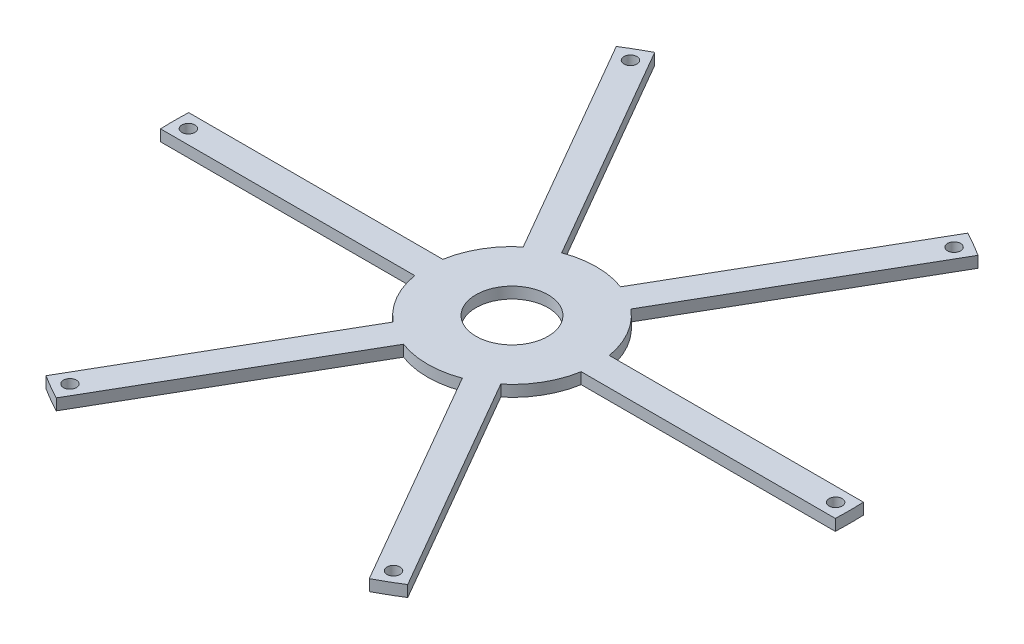
from build123d import *

# Parameters (mm, degrees)
BOSS_EXTRUDE1_DEPTH         = 2.54
F_5_8_CLEARANCE_HOLE1_D     = 16.27124
F_5_8_CLEARANCE_HOLE1_DEPTH = 38.354
F_5_8_CLEARANCE_HOLE1_TIP   = 4.888373669
F_4_CLEARANCE_HOLE1_D       = 2.9464
F_4_CLEARANCE_HOLE1_DEPTH   = 38.354
F_4_CLEARANCE_HOLE1_TIP     = 0.885187864


with BuildPart() as part:
    # Sketch1 → Boss-Extrude1 (new body)
    with BuildSketch(Plane(origin=(0, 0, 0), x_dir=(1, 0, 0), z_dir=(0, 1, 0))):
        with BuildLine():
            Line((18.783553311, 3.175), (76.133825433, 3.175))
            ThreePointArc((76.133825433, 3.175), (76.2, 0), (76.133825433, -3.175))
            Line((76.133825433, -3.175), (18.783553311, -3.175))
            ThreePointArc((18.783553311, -3.175), (16.497783942, -9.525), (12.141407313, -14.679534341))
            Line((12.141407313, -14.679534341), (40.816543373, -64.346326912))
            ThreePointArc((40.816543373, -64.346326912), (38.1, -65.991135768), (35.317282059, -67.521326912))
            Line((35.317282059, -67.521326912), (6.642145999, -17.854534341))
            ThreePointArc((6.642145999, -17.854534341), (0, -19.05), (-6.642145999, -17.854534341))
            Line((-6.642145999, -17.854534341), (-35.317282059, -67.521326912))
            ThreePointArc((-35.317282059, -67.521326912), (-38.1, -65.991135768), (-40.816543373, -64.346326912))
            Line((-40.816543373, -64.346326912), (-12.141407313, -14.679534341))
            ThreePointArc((-12.141407313, -14.679534341), (-16.497783942, -9.525), (-18.783553311, -3.175))
            Line((-18.783553311, -3.175), (-76.133825433, -3.175))
            ThreePointArc((-76.133825433, -3.175), (-76.2, 0), (-76.133825433, 3.175))
            Line((-76.133825433, 3.175), (-18.783553311, 3.175))
            ThreePointArc((-18.783553311, 3.175), (-16.497783942, 9.525), (-12.141407313, 14.679534341))
            Line((-12.141407313, 14.679534341), (-40.816543373, 64.346326912))
            ThreePointArc((-40.816543373, 64.346326912), (-38.1, 65.991135768), (-35.317282059, 67.521326912))
            Line((-35.317282059, 67.521326912), (-6.642145999, 17.854534341))
            ThreePointArc((-6.642145999, 17.854534341), (0, 19.05), (6.642145999, 17.854534341))
            Line((6.642145999, 17.854534341), (35.317282059, 67.521326912))
            ThreePointArc((35.317282059, 67.521326912), (38.1, 65.991135768), (40.816543373, 64.346326912))
            Line((40.816543373, 64.346326912), (12.141407313, 14.679534341))
            ThreePointArc((12.141407313, 14.679534341), (16.497783942, 9.525), (18.783553311, 3.175))
        make_face()
    extrude(amount=BOSS_EXTRUDE1_DEPTH)

    # 5/8 Clearance Hole1
    with Locations(Plane(origin=(0, 2.54, 0), x_dir=(1, 0, 0), z_dir=(0, 1, 0))):
        with Locations((0, 0)):
            Hole(F_5_8_CLEARANCE_HOLE1_D / 2, depth=F_5_8_CLEARANCE_HOLE1_DEPTH)
            with Locations((0, 0, -(F_5_8_CLEARANCE_HOLE1_DEPTH + F_5_8_CLEARANCE_HOLE1_TIP / 2))):  # 118° drill point
                Cone(0, F_5_8_CLEARANCE_HOLE1_D / 2, F_5_8_CLEARANCE_HOLE1_TIP, mode=Mode.SUBTRACT)

    # #4 Clearance Hole1
    with Locations(Plane(origin=(0, 2.54, 0), x_dir=(1, 0, 0), z_dir=(0, 1, 0))):
        with Locations((-73.025, 0), (-36.5125, 63.241505111), (36.5125, 63.241505111), (73.025, 0), (36.5125, -63.241505111), (-36.5125, -63.241505111)):
            Hole(F_4_CLEARANCE_HOLE1_D / 2, depth=F_4_CLEARANCE_HOLE1_DEPTH)
            with Locations((0, 0, -(F_4_CLEARANCE_HOLE1_DEPTH + F_4_CLEARANCE_HOLE1_TIP / 2))):  # 118° drill point
                Cone(0, F_4_CLEARANCE_HOLE1_D / 2, F_4_CLEARANCE_HOLE1_TIP, mode=Mode.SUBTRACT)


solid = part.part
